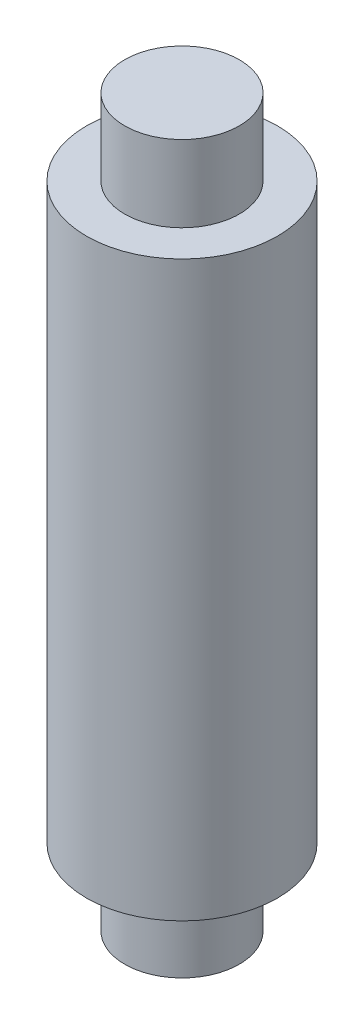
from build123d import *


with BuildPart() as part:
    # Sketch1 → Revolve1 (revolve)
    with BuildSketch(Plane.XY):
        Polygon((0, -11.660094277), (0, -30.660094277), (-1.5, -30.660094277), (-1.5, -28.660094277), (-2.5, -28.660094277), (-2.5, -13.660094277), (-1.5, -13.660094277), (-1.5, -11.660094277), align=None)
    revolve(axis=Axis((0, -11.660094277, 0), (0, -1, 0)))


solid = part.part
